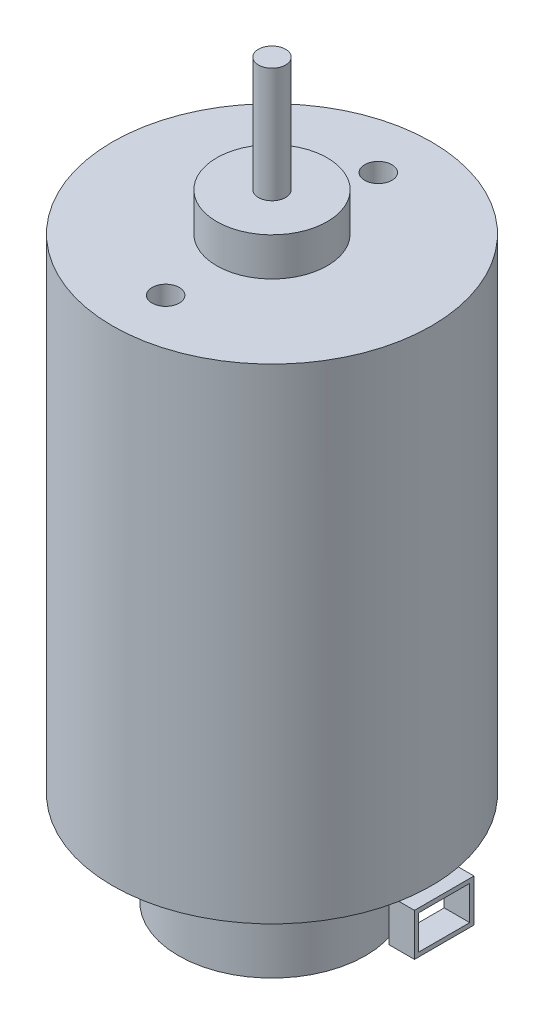
from build123d import *

# Parameters (mm, degrees)
SKETCH_1_R          = 18.75
EXTRUDE_1_DEPTH     = 57
SKETCH_2_R          = 11
EXTRUDE_2_DEPTH     = 11
SKETCH_3_W          = 3
SKETCH_3_H          = 7
EXTRUDE_3_DEPTH     = 5
SKETCH_4_W          = 6
SKETCH_4_H          = 4
CUT_EXTRUDE_1_DEPTH = 3
SKETCH_5_R          = 6.5
EXTRUDE_4_DEPTH     = 4.5
SKETCH_6_R          = 1.6
CUT_EXTRUDE_2_DEPTH = 4
SKETCH_7_R          = 1.6
EXTRUDE_5_DEPTH     = 13.5


with BuildPart() as part:
    # 草图1 → 凸台-拉伸1 (new body)
    with BuildSketch(Plane(origin=(0, 0, 0), x_dir=(1, 0, 0), z_dir=(0, 1, 0))):
        with Locations(Location((0, 0, 0), (0, 0, 90))):
            Circle(SKETCH_1_R)
    extrude(amount=EXTRUDE_1_DEPTH)

    # 草图2 → 凸台-拉伸2 (add)
    with BuildSketch(Plane.XZ):
        with Locations(Location((0, 0, 0), (0, 0, 90))):
            Circle(SKETCH_2_R)
    extrude(amount=EXTRUDE_2_DEPTH)

    # 草图3 → 凸台-拉伸3 (add)
    with BuildSketch(Plane.XZ):
        with Locations((18.75, 0)):
            Rectangle(SKETCH_3_W, SKETCH_3_H)
    extrude(amount=EXTRUDE_3_DEPTH)

    # 草图4 → 切除-拉伸1 (cut)
    with BuildSketch(Plane(origin=(20.25, 0, 0), x_dir=(0, 0, -1), z_dir=(1, 0, 0))):
        with Locations((0, -2.5)):
            Rectangle(SKETCH_4_W, SKETCH_4_H)
    extrude(amount=-CUT_EXTRUDE_1_DEPTH, mode=Mode.SUBTRACT)

    # 草图5 → 凸台-拉伸4 (add)
    with BuildSketch(Plane(origin=(0, 57, 0), x_dir=(1, 0, 0), z_dir=(0, 1, 0))):
        with Locations(Location((0, 0, 0), (0, 0, 270))):
            Circle(SKETCH_5_R)
    extrude(amount=EXTRUDE_4_DEPTH)

    # 草图6 → 切除-拉伸2 (cut)
    with BuildSketch(Plane(origin=(0, 57, 0), x_dir=(1, 0, 0), z_dir=(0, 1, 0))):
        with Locations(Location((0, -12.5, 0), (0, 0, 270))):
            Circle(SKETCH_6_R)
        with Locations(Location((0, 12.5, 0), (0, 0, 270))):
            Circle(SKETCH_6_R)
    extrude(amount=-CUT_EXTRUDE_2_DEPTH, mode=Mode.SUBTRACT)

    # 草图7 → 凸台-拉伸5 (add)
    with BuildSketch(Plane(origin=(0, 61.5, 0), x_dir=(1, 0, 0), z_dir=(0, 1, 0))):
        with Locations(Location((0, 0, 0), (0, 0, 270))):
            Circle(SKETCH_7_R)
    extrude(amount=EXTRUDE_5_DEPTH)


solid = part.part
